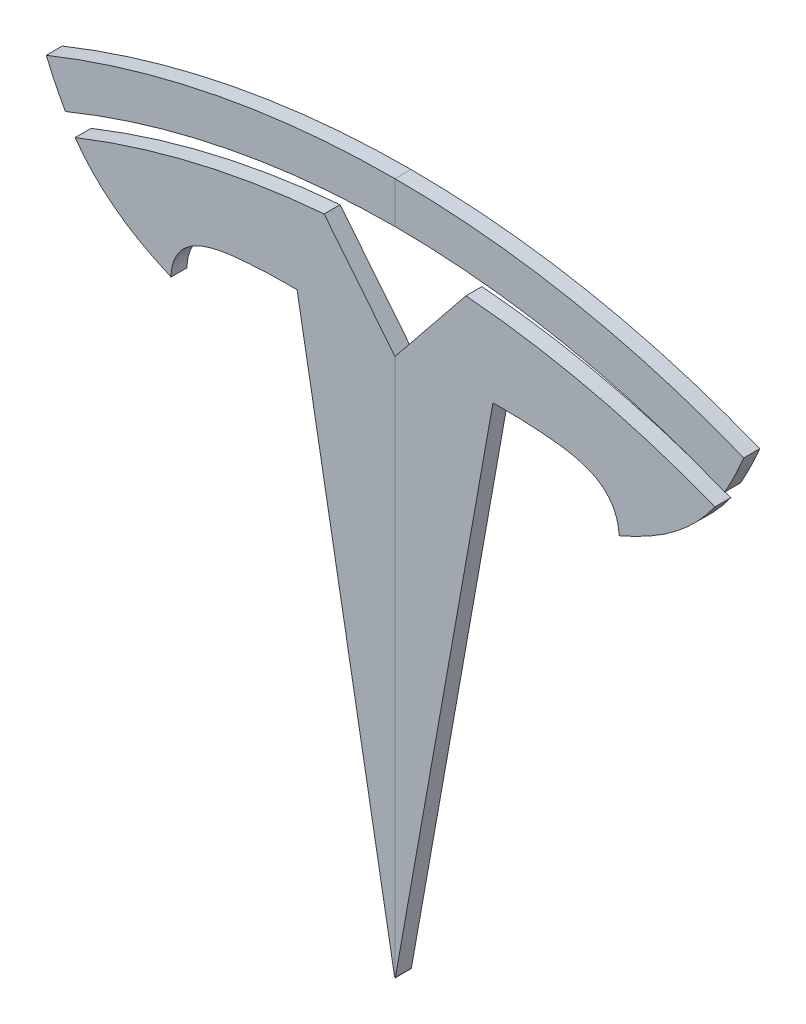
from build123d import *

# Parameters (mm, degrees)
EXTRUDE_1_DEPTH   = 2
EXTRUDE_1_2_DEPTH = 2


with BuildPart() as part:
    # 草图4 → 凸台-拉伸1 (new body)
    with BuildSketch(Plane.XY):
        with BuildLine():
            Line((129.754075071, 135.691919441), (130.907867432, 135.696136475))
            ThreePointArc((130.907867432, 135.696136475), (134.565751216, 135.60175956), (138.211736169, 135.292220379))
            Line((138.211736169, 135.292220379), (138.826217651, 135.197784424))
            ThreePointArc((138.826217651, 135.197784424), (140.120063117, 134.940887305), (141.384659698, 134.56561713))
            ThreePointArc((141.384659698, 134.56561713), (142.906940981, 133.857183707), (144.196597811, 132.782007684))
            ThreePointArc((144.196597811, 132.782007684), (145.183330218, 131.10158314), (145.529755049, 129.183913374))
            ThreePointArc((145.529755049, 129.183913374), (148.547404982, 130.623014397), (151.425386163, 132.324321891))
            ThreePointArc((151.425386163, 132.324321891), (151.40801976, 132.330242443), (151.390651634, 132.336157937))
            ThreePointArc((151.390651634, 132.336157937), (154.736109947, 135.038022712), (157.532027719, 138.305285848))
            ThreePointArc((157.532027719, 138.305285848), (142.220764521, 143.112508129), (126.367587205, 145.606688512))
            Line((126.367587205, 145.606688512), (117.501791432, 134.597120738))
            Line((117.501791432, 134.597120738), (117.495472491, 134.589273862))
            Line((117.495472491, 134.589273862), (117.494872633, 67.224367653))
            Line((117.494872633, 67.224367653), (117.548172453, 67.340042661))
            Line((117.548172453, 67.340042661), (129.754075071, 135.691919441))
        make_face()
    extrude(amount=EXTRUDE_1_DEPTH)


with BuildPart() as body_2:
    # 草图4 → Extrude 1 2 (new body)
    with BuildSketch(Plane.XY):
        with BuildLine():
            Line((117.495644097, 153.860880328), (117.495597882, 148.670868738))
            ThreePointArc((117.495597882, 148.670868738), (138.52210518, 146.608292632), (158.752427095, 140.517126524))
            ThreePointArc((158.752427095, 140.517126524), (160.02206081, 142.932720764), (161.14615728, 145.419379652))
            ThreePointArc((161.14615728, 145.419379652), (139.725666091, 151.733148545), (117.495644097, 153.860880328))
        make_face()
    extrude(amount=EXTRUDE_1_2_DEPTH)


with BuildPart() as body_3:
    # 镜向1: mirrored copy
    add(body_2.part.mirror(Plane(origin=(117.494274017, -0.00104624, 2), x_dir=(0, 0, 1), z_dir=(0.999999999960354, -8.904603525034718e-06, 0))))


with BuildPart() as body_4:
    # Mirror 1 2: mirrored copy
    add(part.part.mirror(Plane(origin=(117.494274017, -0.00104624, 2), x_dir=(0, 0, 1), z_dir=(0.999999999960354, -8.904603525034718e-06, 0))))


solid = Compound([part.part, body_2.part, body_3.part, body_4.part])
